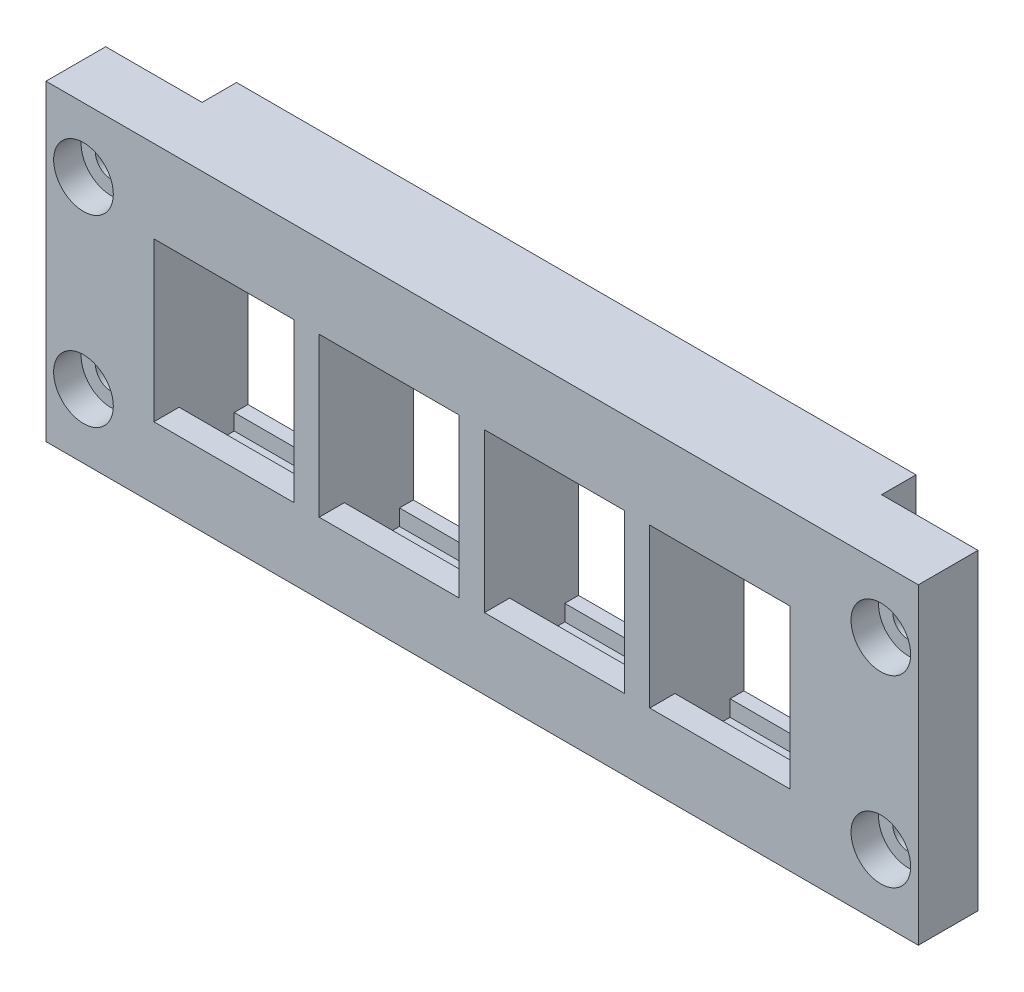
from build123d import *

# Parameters (mm, degrees)
SKETCH1_W                      = 95
SKETCH1_H                      = 34
BOSS_EXTRUDE1_DEPTH            = 6.5
SKETCH2_W                      = 74
SKETCH2_H                      = 34
BOSS_EXTRUDE2_DEPTH            = 3.75
CBORE_FOR_M3_SHCS1_D           = 3.4
CBORE_FOR_M3_SHCS1_DEPTH       = 10.1
CBORE_FOR_M3_SHCS1_CBORE_D     = 6.5
CBORE_FOR_M3_SHCS1_CBORE_DEPTH = 3
CBORE_FOR_M3_SHCS1_TIP         = 1.021463052
CUT_EXTRUDE1_DEPTH             = 15.25
LPATTERN1_COUNT                = 4
LPATTERN1_PITCH                = 18


with BuildPart() as part:
    # Sketch1 → Boss-Extrude1 (new body)
    with BuildSketch(Plane.XY):
        Rectangle(SKETCH1_W, SKETCH1_H)
    extrude(amount=BOSS_EXTRUDE1_DEPTH)

    # Sketch2 → Boss-Extrude2 (add)
    with BuildSketch(Plane(origin=(0, 0, 0), x_dir=(-1, 0, 0), z_dir=(0, 0, -1))):
        Rectangle(SKETCH2_W, SKETCH2_H)
    extrude(amount=BOSS_EXTRUDE2_DEPTH)

    # CBORE for M3 SHCS1
    with Locations(Plane.XY.offset(6.5)):
        with Locations((-43.42, 10), (-43.42, -10), (43.42, 10), (43.42, -10)):
            CounterBoreHole(CBORE_FOR_M3_SHCS1_D / 2, CBORE_FOR_M3_SHCS1_CBORE_D / 2, CBORE_FOR_M3_SHCS1_CBORE_DEPTH, depth=CBORE_FOR_M3_SHCS1_DEPTH)
            with Locations((0, 0, -(CBORE_FOR_M3_SHCS1_DEPTH + CBORE_FOR_M3_SHCS1_TIP / 2))):  # 118° drill point
                Cone(0, CBORE_FOR_M3_SHCS1_D / 2, CBORE_FOR_M3_SHCS1_TIP, mode=Mode.SUBTRACT)

    # Sketch7 → Cut-Extrude1 (cut)
    with BuildSketch(Plane(origin=(33.5, 0, 0), x_dir=(0, 0, -1), z_dir=(1, 0, 0))):
        Polygon((-6.503383917, 8.006767833), (-3.756779362, 8.006767833), (-3.756779362, 9.003383917), (2.246616083, 9.003383917), (2.246616083, 7.503383917), (3.746616083, 7.503383917), (6.355468839, 7.503383917), (6.355468839, -12.746616083), (3.871124209, -12.746616083), (3.746616083, -12.746616083), (2.246616083, -12.746616083), (2.246616083, -14.496616083), (-3.756779362, -14.496616083), (-3.756779362, -9.25), (-6.503383917, -9.25), align=None)
    cut_extrude1 = extrude(amount=-CUT_EXTRUDE1_DEPTH, mode=Mode.SUBTRACT)

    # LPattern1: Cut-Extrude1 ×4
    with Locations(*[(-i * LPATTERN1_PITCH, 0, 0) for i in range(1, LPATTERN1_COUNT)]):
        add(cut_extrude1, mode=Mode.SUBTRACT)


solid = part.part
